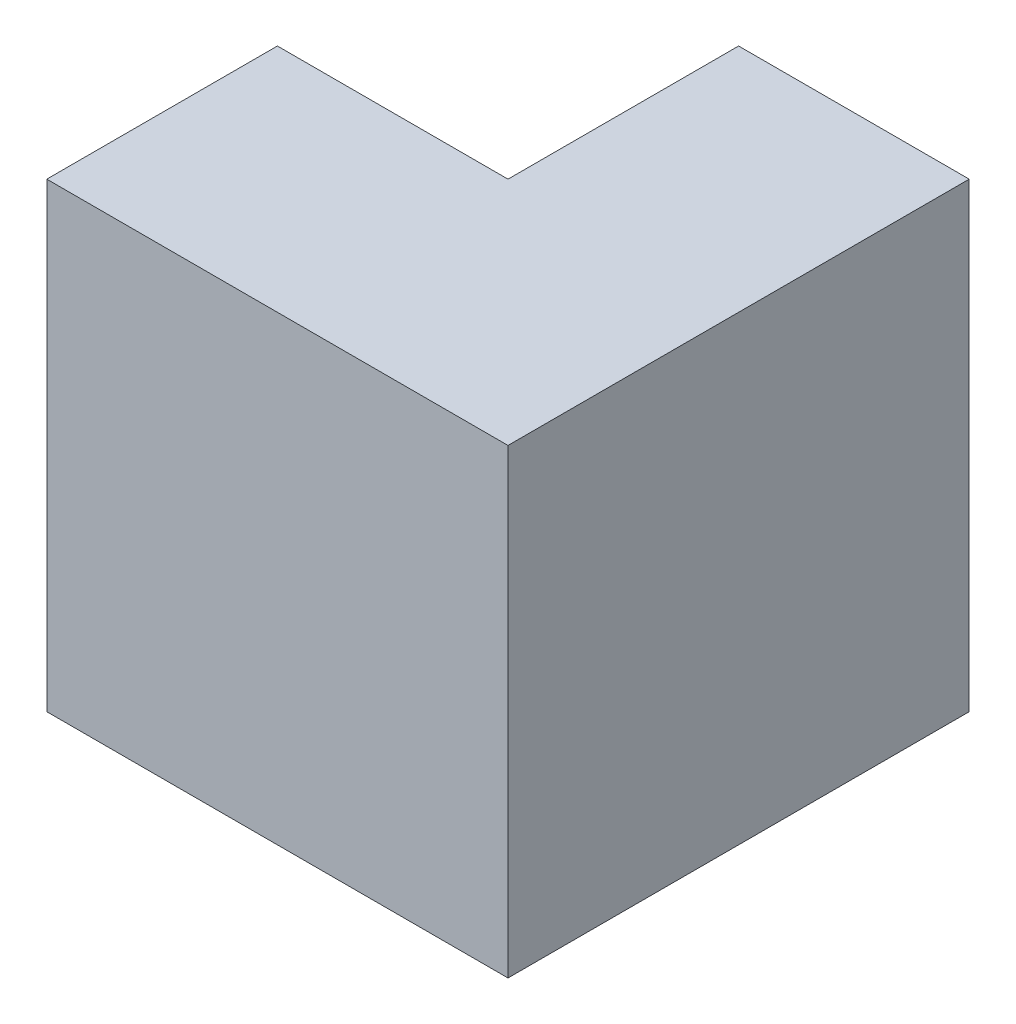
from build123d import *

# Parameters (mm, degrees)
EXTRUDE_1_DEPTH     = 40
EXTRUDE_2_DEPTH     = 40
CUT_EXTRUDE_1_DEPTH = 40
CUT_EXTRUDE_2_DEPTH = 40


with BuildPart() as part:
    # 草图1 → 凸台-拉伸1 (new body)
    with BuildSketch(Plane(origin=(0, 0, 0), x_dir=(1, 0, 0), z_dir=(0, 1, 0))):
        Polygon((-6.780821918, 7.191780822), (13.219178082, 7.191780822), (13.219178082, -32.808219178), (-6.780821918, -32.808219178), (-26.780821918, -32.808219178), (-26.780821918, -12.808219178), (-6.780821918, -12.808219178), align=None)
    extrude(amount=EXTRUDE_1_DEPTH)

    # 草图2 → 凸台-拉伸2 (add)
    with BuildSketch(Plane.XZ):
        Polygon((-6.780821918, -7.191780822), (-26.780821918, 12.808219178), (-6.780821918, 12.808219178), align=None)
    extrude(amount=-EXTRUDE_2_DEPTH)

    # 草图3 → 切除-拉伸1 (cut)
    with BuildSketch(Plane.XY.offset(12.808219178)):
        Polygon((-6.780821918, 40), (-26.780821918, 0), (-26.780821918, 40), align=None)
    extrude(amount=-CUT_EXTRUDE_1_DEPTH, mode=Mode.SUBTRACT)

    # 草图4 → 切除-拉伸2 (cut)
    with BuildSketch(Plane(origin=(-6.780821918, 0, 0), x_dir=(0, 0, -1), z_dir=(1, 0, 0))):
        Polygon((-12.808219178, 40), (7.191780822, 0), (7.191780822, 40), align=None)
    extrude(amount=-CUT_EXTRUDE_2_DEPTH, mode=Mode.SUBTRACT)


solid = part.part
